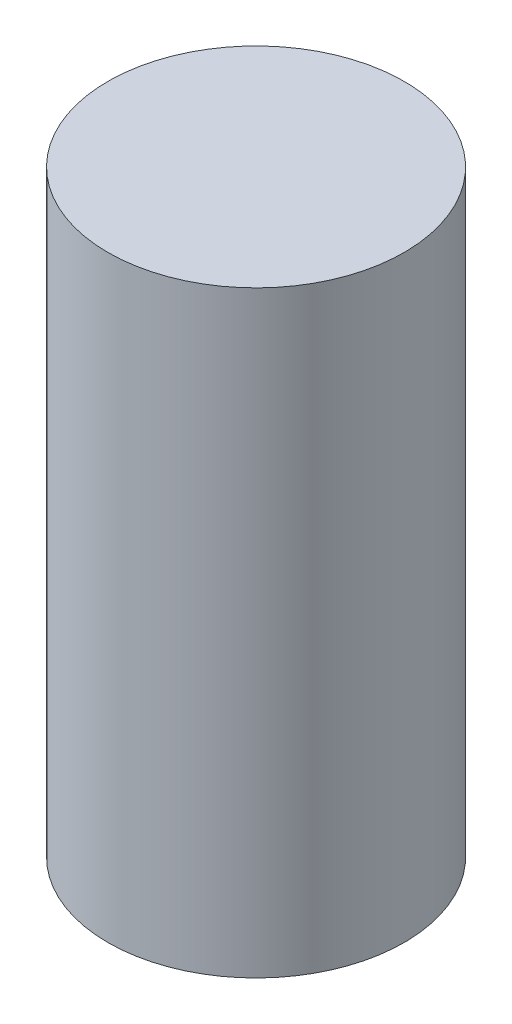
from build123d import *

# Parameters (mm, degrees)
SKETCH1_R           = 29.75
BOSS_EXTRUDE1_DEPTH = 120


with BuildPart() as part:
    # Sketch1 → Boss-Extrude1 (new body)
    with BuildSketch(Plane(origin=(0, 0, 0), x_dir=(1, 0, 0), z_dir=(0, 1, 0))):
        with Locations(Location((0, 0, 0), (0, 0, 270))):
            Circle(SKETCH1_R)
    extrude(amount=BOSS_EXTRUDE1_DEPTH)


solid = part.part
